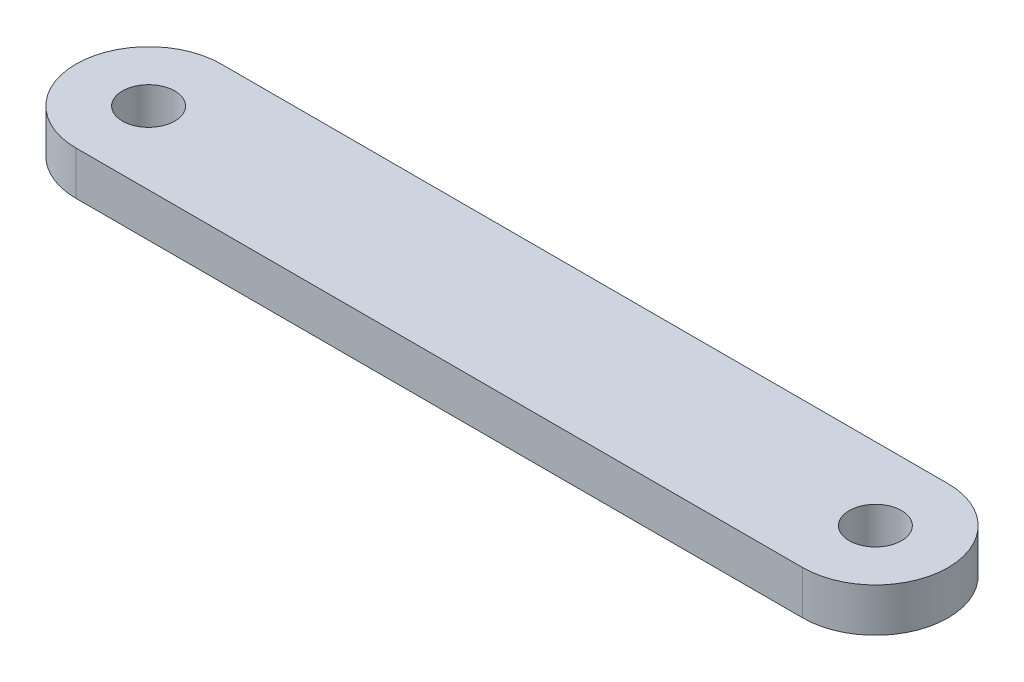
from build123d import *

# Parameters (mm, degrees)
SKETCH_1_R      = 1.8
EXTRUDE_1_DEPTH = 3


with BuildPart() as part:
    # 草图1 → 凸台-拉伸1 (new body)
    with BuildSketch(Plane(origin=(0, 0, 0), x_dir=(1, 0, 0), z_dir=(0, 1, 0))):
        with BuildLine():
            Line((0, 5), (50, 5))
            ThreePointArc((50, 5), (55, 0), (50, -5))
            Line((50, -5), (0, -5))
            ThreePointArc((0, -5), (-5, 0), (0, 5))
        make_face()
        with Locations(Location((0, 0, 0), (0, 0, 270))):
            Circle(SKETCH_1_R, mode=Mode.SUBTRACT)
        with Locations(Location((50, 0, 0), (0, 0, 270))):
            Circle(SKETCH_1_R, mode=Mode.SUBTRACT)
    extrude(amount=EXTRUDE_1_DEPTH)


solid = part.part
